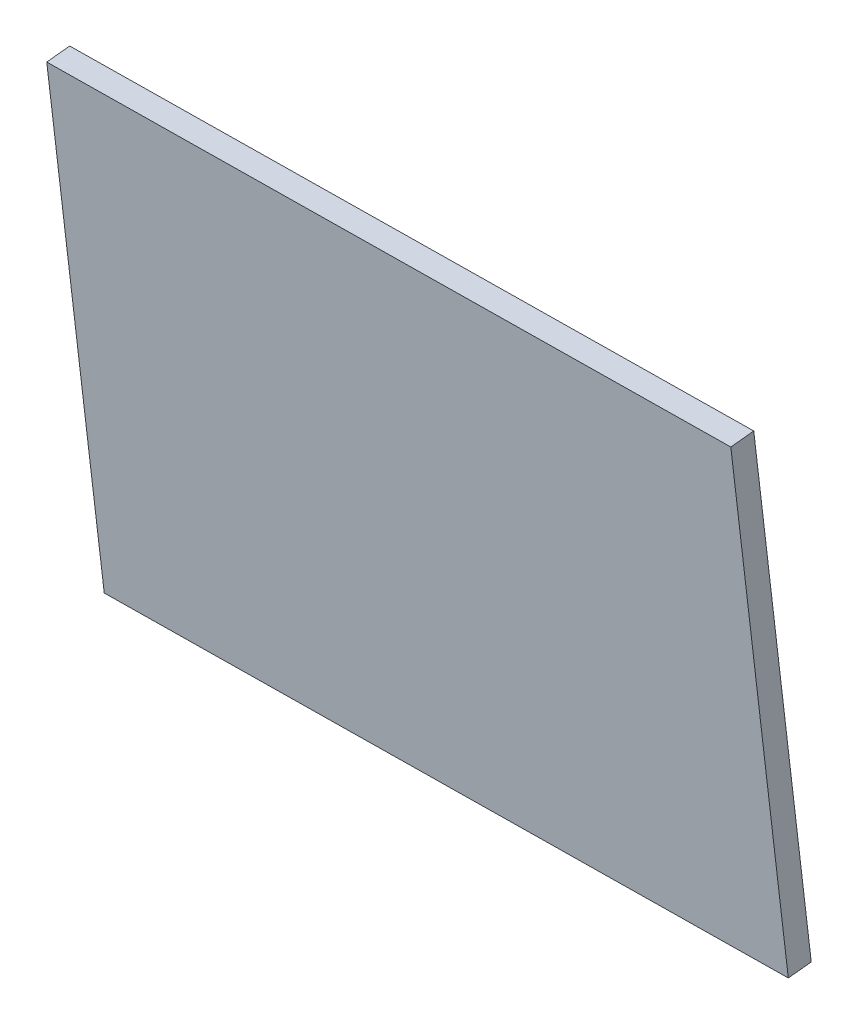
from build123d import *

# Parameters (mm, degrees)
BOSS_EXTRUDE1_DEPTH = 10


with BuildPart() as part:
    # Sketch1 → Boss-Extrude1 (new body)
    with BuildSketch(Plane(origin=(0, 22.045265659, -209.746691971), x_dir=(-1, 0, 0), z_dir=(0, 0.1045284632676533, -0.9945218953682734))):
        Polygon((-439.924011728, -699.334359964), (-142.953847047, -703.544026118), (-145.930378671, -913.522930438), (-442.900543352, -909.313264284), align=None)
    extrude(amount=-BOSS_EXTRUDE1_DEPTH)


solid = part.part
